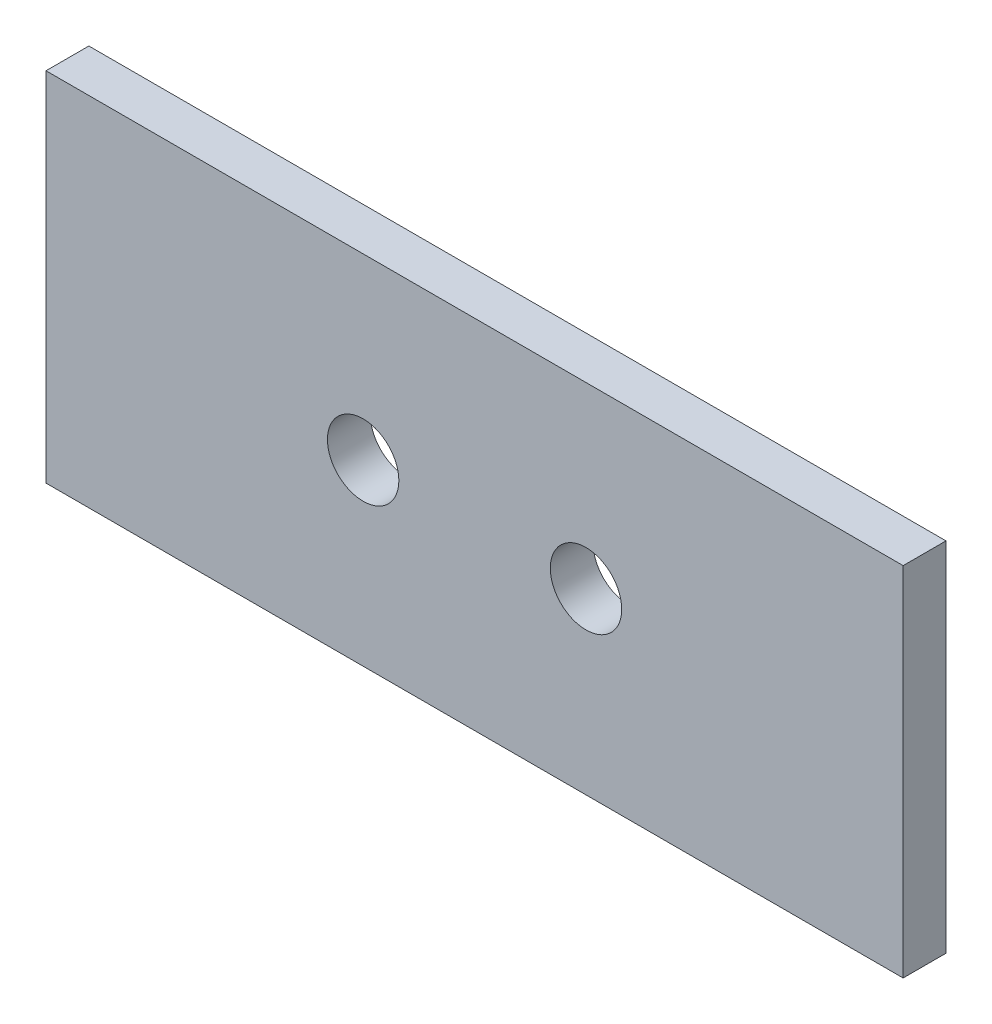
from build123d import *

# Parameters (mm, degrees)
SKETCH1_W          = 60
SKETCH1_H          = 25
EXTRUDE1_DEPTH     = 1.5
SKETCH2_R          = 2.5
CUT_EXTRUDE1_DEPTH = 10


with BuildPart() as part:
    # Sketch1 → Extrude1 (new, symmetric)
    with BuildSketch(Plane.XY):
        Rectangle(SKETCH1_W, SKETCH1_H)
    extrude(amount=EXTRUDE1_DEPTH, both=True)

    # Sketch2 → Cut-Extrude1 (cut)
    with BuildSketch(Plane.XY.offset(1.5)):
        with Locations((-7.8, 0)):
            Circle(SKETCH2_R)
        with Locations((7.8, 0)):
            Circle(SKETCH2_R)
    extrude(amount=-CUT_EXTRUDE1_DEPTH, mode=Mode.SUBTRACT)


solid = part.part
